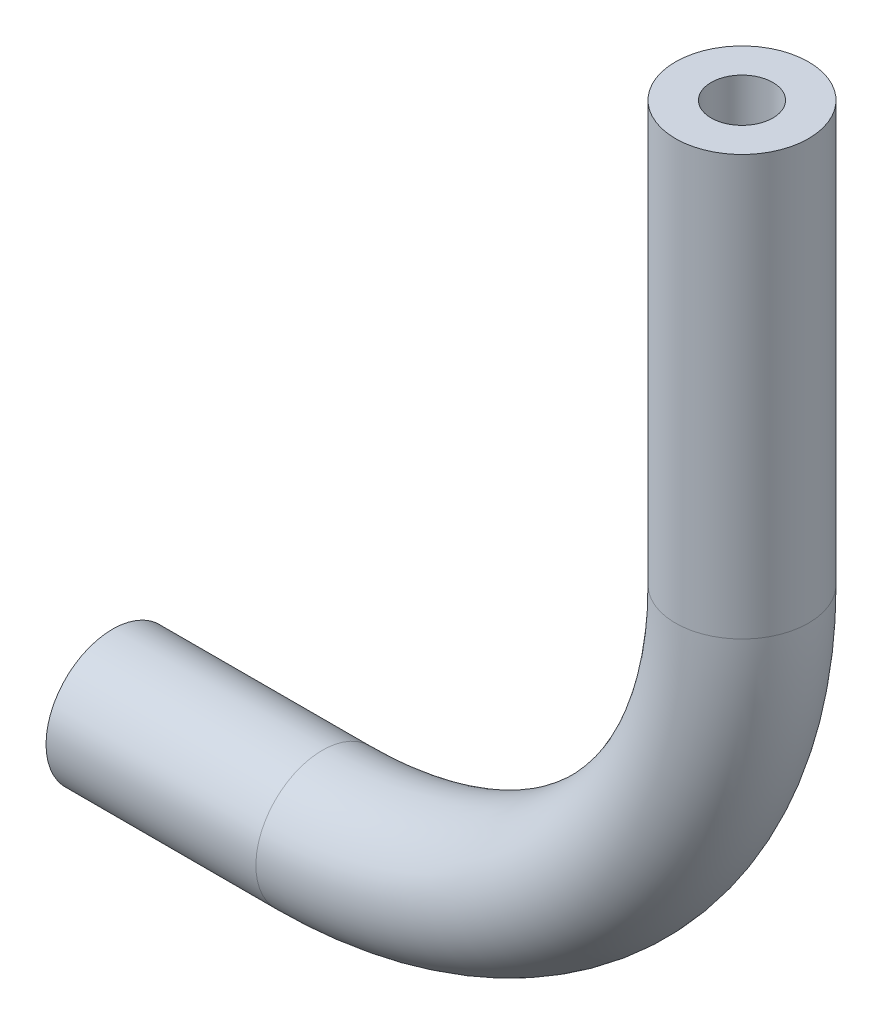
from build123d import *

# Parameters (mm, degrees)
SWEEP_SOTTILE1_PROFILE_R   = 1.585
SWEEP_SOTTILE1_PROFILE_R_2 = 0.735


with BuildPart() as part:
    # Sweep-Sottile1: sweep along a curve in space
    with BuildLine() as sweep_sottile1_path:
        Line((0, 20, 0), (0, 10, 0))
        ThreePointArc((0, 10, 0), (-2.928932188, 2.928932188, 0), (-10, 0, 0))
        Line((-10, 0, 0), (-15, 0, 0))
    # Sweep-Sottile1 profile (on start of the path) → Sweep-Sottile1 (sweep)
    with BuildSketch(Plane(origin=(0, 20, 0), x_dir=(0, 0, -1), z_dir=(0, -1, 0))):
        Circle(SWEEP_SOTTILE1_PROFILE_R)
        Circle(SWEEP_SOTTILE1_PROFILE_R_2, mode=Mode.SUBTRACT)
    sweep(path=sweep_sottile1_path.line)


solid = part.part
